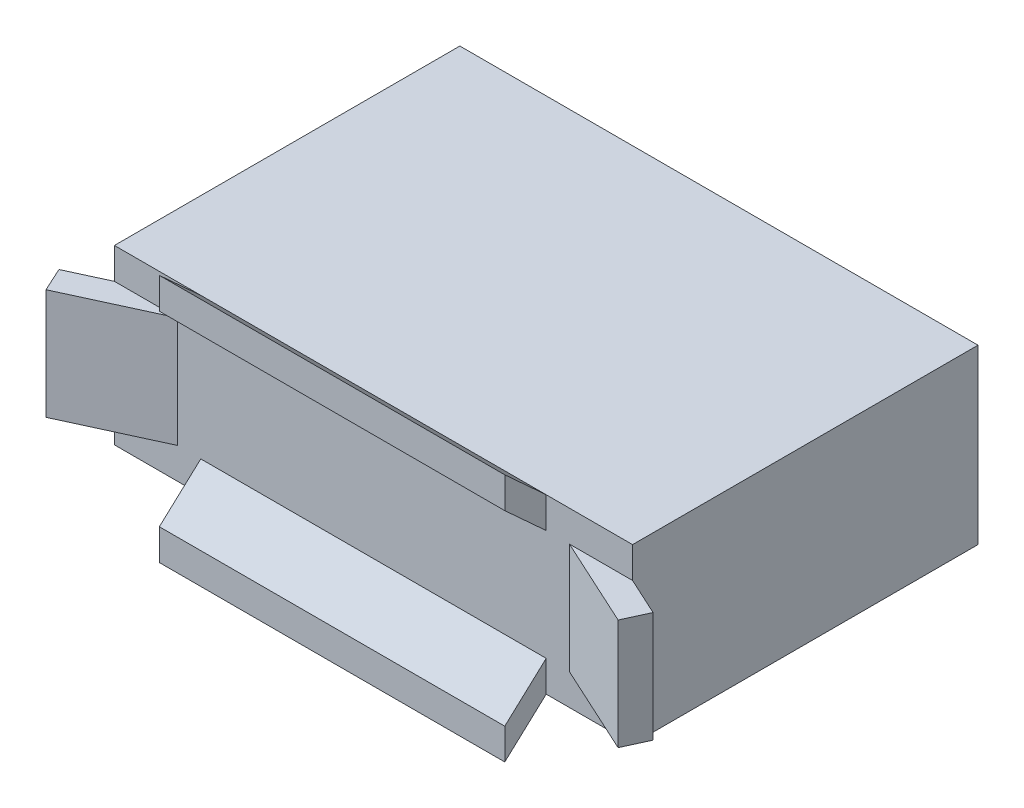
from build123d import *

# Parameters (mm, degrees)
BOSS_EXTRUDE1_DEPTH      = 1.25
BOSS_EXTRUDE1_DEPTH_BACK = 1.25
SKETCH1_W                = 7.5
SKETCH1_H                = 5
BOSS_EXTRUDE2_DEPTH      = 0.8
BOSS_EXTRUDE2_DEPTH_BACK = 0.8
BOSS_EXTRUDE3_DEPTH      = 2.5
BOSS_EXTRUDE3_DEPTH_BACK = 2.5


with BuildPart() as part:
    # Sketch1 → Boss-Extrude1 (new, two sides: drawn at the far end of the back side and taken through both)
    with BuildSketch(Plane(origin=(0, 0, 0), x_dir=(1, 0, 0), z_dir=(0, 1, 0)).offset(-BOSS_EXTRUDE1_DEPTH_BACK)):
        Rectangle(SKETCH1_W, SKETCH1_H)
    extrude(amount=BOSS_EXTRUDE1_DEPTH + BOSS_EXTRUDE1_DEPTH_BACK)

    # Sketch3 → Boss-Extrude2 (add, two sides: drawn at the far end of the back side and taken through both)
    with BuildSketch(Plane(origin=(0, 0, 0), x_dir=(1, 0, 0), z_dir=(0, 1, 0)).offset(-BOSS_EXTRUDE2_DEPTH_BACK)):
        Polygon((-3.75, -2.5), (-4.3, -2.752945266), (-4.14038936, -3.1), (-2.835759292, -2.5), align=None)
        Polygon((3.75, -2.5), (2.835759292, -2.5), (4.14038936, -3.1), (4.3, -2.752945266), align=None)
    extrude(amount=BOSS_EXTRUDE2_DEPTH + BOSS_EXTRUDE2_DEPTH_BACK)

    # Sketch5 → Boss-Extrude3 (add, two sides: drawn at the far end of the back side and taken through both)
    with BuildSketch(Plane(origin=(0, 0, 0), x_dir=(0, 0, -1), z_dir=(1, 0, 0)).offset(-BOSS_EXTRUDE3_DEPTH_BACK)):
        Polygon((-2.5, 1.25), (-3.1, 1.8), (-3.1, 1.350797038), (-2.5, 0.800797038), align=None)
        Polygon((-2.5, -0.800797038), (-2.5, -1.25), (-3.1, -1.8), (-3.1, -1.350797038), align=None)
    extrude(amount=BOSS_EXTRUDE3_DEPTH + BOSS_EXTRUDE3_DEPTH_BACK)


solid = part.part
